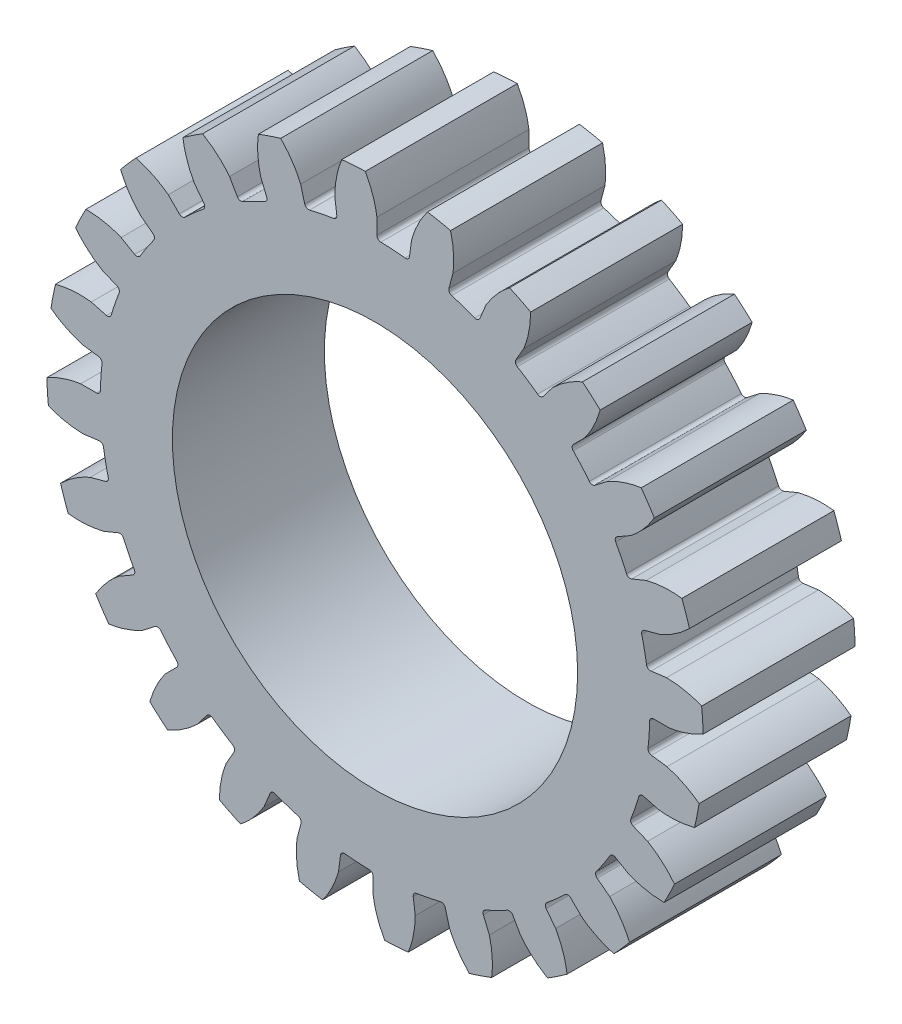
from build123d import *

# Parameters (mm, degrees)
SKETCH1_R                = 10.287
BOSS_EXTRUDE1_DEPTH      = 4.7625
CUT_EXTRUDE1_DEPTH       = 16.307715187
FILLET1_R                = 0.12468225
CIRPATTERN1_COUNT        = 24
FILLET1_OF_CIRPATTERN1_R = 0.12468225
SKETCH5_R                = 6.35
CUT_EXTRUDE2_DEPTH       = 16.301686132


with BuildPart() as part:
    # Sketch1 → Boss-Extrude1 (new body)
    with BuildSketch(Plane.XY):
        Circle(SKETCH1_R)
    extrude(amount=-BOSS_EXTRUDE1_DEPTH)

    # Sketch4 → Cut-Extrude1 (cut, through all)
    with BuildSketch(Plane.XY):
        with BuildLine():
            Line((0.058743897, 9.221419166), (0.058743897, 8.606430772))
            ThreePointArc((0.058743897, 8.606430772), (0.56290193, 8.588203706), (1.065125916, 8.540468855))
            Line((1.065125916, 8.540468855), (1.145398197, 9.150195913))
            add(Edge.make_bspline(
                [(1.977726525, 10.532617692), (1.36260271, 9.933012741), (1.145398197, 9.150195913)],
                knots=[0, 0, 0, 1, 1, 1], degree=2))
            ThreePointArc((1.977726525, 10.532617692), (0.700906677, 10.693744316), (-0.586021044, 10.70065498))
            add(Edge.make_bspline(
                [(-0.586021044, 10.70065498), (-0.054424055, 10.0258898), (0.058743897, 9.221419166)],
                knots=[0, 0, 0, 1, 1, 1], degree=2))
        make_face()
    cut_extrude1 = extrude(amount=-CUT_EXTRUDE1_DEPTH, mode=Mode.SUBTRACT)

    # Fillet1
    fillet1_edges = [part.edges().sort_by_distance(p)[0] for p in [
        (1.065125916, 8.540468855, -2.38125),
        (0.058743897, 8.606430772, -2.38125),
    ]]
    fillet(fillet1_edges, radius=FILLET1_R)

    # CirPattern1: Cut-Extrude1 ×24 about axis
    cirpattern1_axis = Axis((0, 0, -4.7625), (0, 0, 1))
    for i in range(1, CIRPATTERN1_COUNT):
        add(cut_extrude1.rotate(cirpattern1_axis, i * 360 / CIRPATTERN1_COUNT), mode=Mode.SUBTRACT)

    # Fillet1 of CirPattern1
    fillet1_of_cirpattern1_edges = [part.edges().sort_by_distance(p)[0] for p in [
        (-1.181603363, 8.525134308, -2.38125),
        (-2.170765947, 8.328377794, -2.38125),
        (-3.347808325, 7.928825947, -2.38125),
        (-4.252341679, 7.482759633, -2.38125),
        (-5.285865683, 6.7921812, -2.38125),
        (-6.044127352, 6.127203769, -2.38125),
        (-6.86370003, 5.192660529, -2.38125),
        (-7.424015736, 4.354089093, -2.38125),
        (-7.973784563, 3.239268625, -2.38125),
        (-8.297969715, 2.284250441, -2.38125),
        (-8.540468855, 1.065125916, -2.38125),
        (-8.606430772, 0.058743897, -2.38125),
        (-8.525134308, -1.181603363, -2.38125),
        (-8.328377794, -2.170765947, -2.38125),
        (-7.928825947, -3.347808325, -2.38125),
        (-7.482759633, -4.252341679, -2.38125),
        (-6.7921812, -5.285865683, -2.38125),
        (-6.127203769, -6.044127352, -2.38125),
        (-5.192660529, -6.86370003, -2.38125),
        (-4.354089093, -7.424015736, -2.38125),
        (-3.239268625, -7.973784563, -2.38125),
        (-2.284250441, -8.297969715, -2.38125),
        (-1.065125916, -8.540468855, -2.38125),
        (-0.058743897, -8.606430772, -2.38125),
        (1.181603363, -8.525134308, -2.38125),
        (2.170765947, -8.328377794, -2.38125),
        (3.347808325, -7.928825947, -2.38125),
        (4.252341679, -7.482759633, -2.38125),
        (5.285865683, -6.7921812, -2.38125),
        (6.044127352, -6.127203769, -2.38125),
        (6.86370003, -5.192660529, -2.38125),
        (7.424015736, -4.354089093, -2.38125),
        (7.973784563, -3.239268625, -2.38125),
        (8.297969715, -2.284250441, -2.38125),
        (8.540468855, -1.065125916, -2.38125),
        (8.606430772, -0.058743897, -2.38125),
        (8.525134308, 1.181603363, -2.38125),
        (8.328377794, 2.170765947, -2.38125),
        (7.928825947, 3.347808325, -2.38125),
        (7.482759633, 4.252341679, -2.38125),
        (6.7921812, 5.285865683, -2.38125),
        (6.127203769, 6.044127352, -2.38125),
        (5.192660529, 6.86370003, -2.38125),
        (4.354089093, 7.424015736, -2.38125),
        (3.239268625, 7.973784563, -2.38125),
        (2.284250441, 8.297969715, -2.38125),
    ]]
    fillet(fillet1_of_cirpattern1_edges, radius=FILLET1_OF_CIRPATTERN1_R)

    # Sketch5 → Cut-Extrude2 (cut, through all)
    with BuildSketch(Plane.XY):
        Circle(SKETCH5_R)
    extrude(amount=-CUT_EXTRUDE2_DEPTH, mode=Mode.SUBTRACT)


solid = part.part
